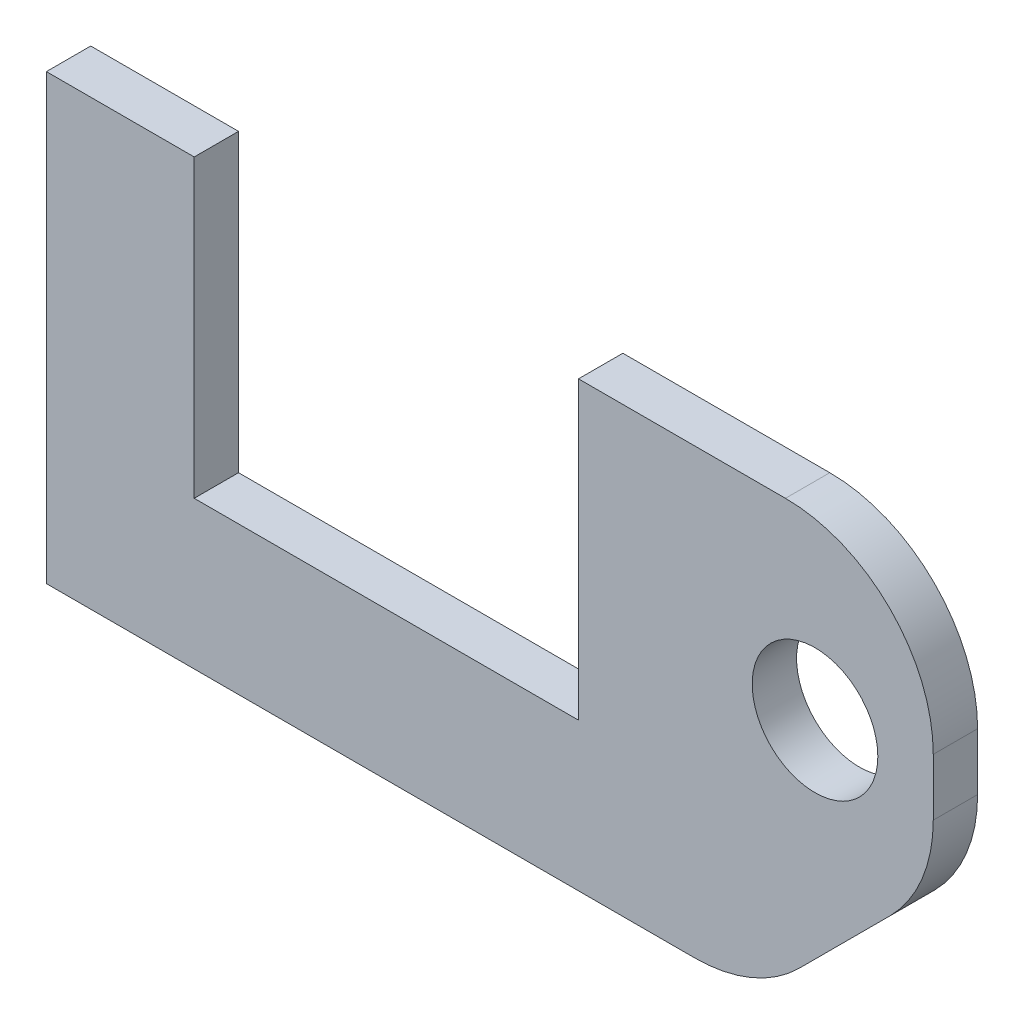
from build123d import *

# Parameters (mm, degrees)
SKETCH1_R           = 4.25
BOSS_EXTRUDE1_DEPTH = 3
CHAMFER1_SIZE       = 12
FILLET1_R           = 10
FILLET2_R           = 10


with BuildPart() as part:
    # Sketch1 → Boss-Extrude1 (new body)
    with BuildSketch(Plane.XY):
        Polygon((0, 30), (0, 0), (60, 0), (60, 30), (36, 30), (36, 10), (10, 10), (10, 30), align=None)
        with Locations((52, 18)):
            Circle(SKETCH1_R, mode=Mode.SUBTRACT)
    extrude(amount=BOSS_EXTRUDE1_DEPTH)

    # Chamfer1
    chamfer1_edges = [part.edges().sort_by_distance(p)[0] for p in [
        (60, 0, 1.5),
    ]]
    chamfer(chamfer1_edges, length=CHAMFER1_SIZE)

    # Fillet1
    fillet1_edges = [part.edges().sort_by_distance(p)[0] for p in [
        (60, 30, 1.5),
    ]]
    fillet(fillet1_edges, radius=FILLET1_R)

    # Fillet2
    fillet2_edges = [part.edges().sort_by_distance(p)[0] for p in [
        (60, 12, 1.5),
        (48, 0, 1.5),
    ]]
    fillet(fillet2_edges, radius=FILLET2_R)


solid = part.part
